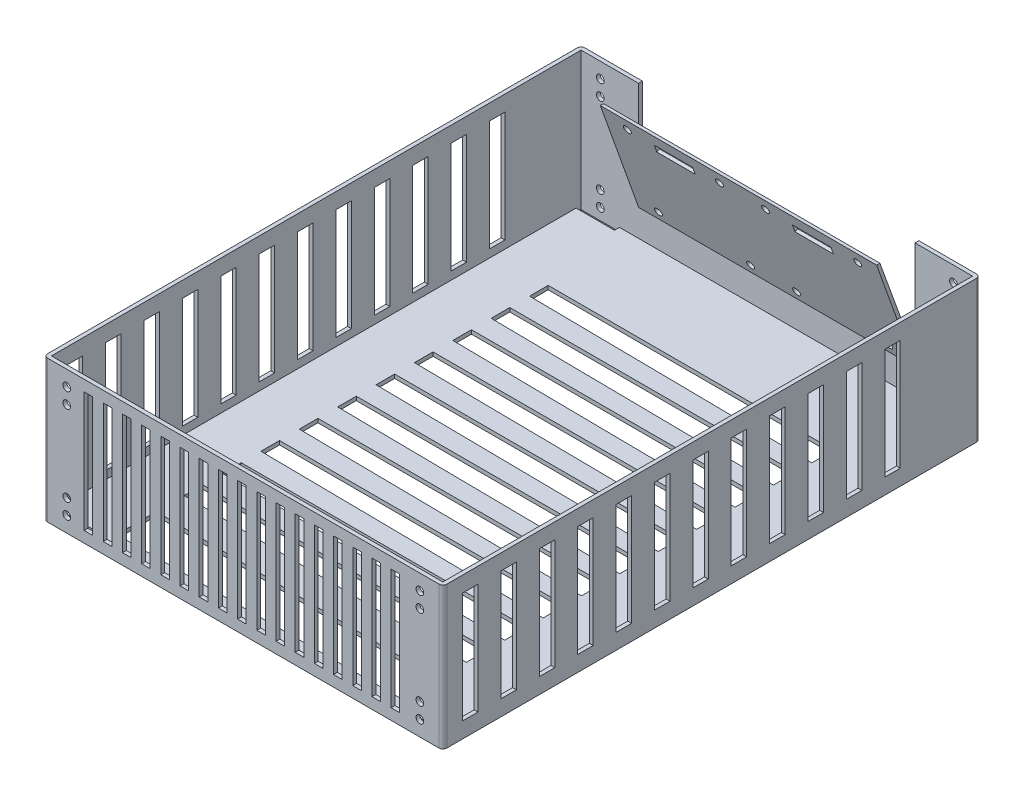
from build123d import *

# Parameters (mm, degrees)
SKETCH2_W                = 104
SKETCH2_H                = 140
BOSS_EXTRUDE1_DEPTH      = 1
BOSS_EXTRUDE2_DEPTH      = 35
BOSS_EXTRUDE2_DEPTH_BACK = 2
SKETCH3_W                = 104
SKETCH3_H                = 140
SKETCH3_W_2              = 102
SKETCH3_H_2              = 138
SKETCH4_W                = 103
SKETCH4_H                = 139
SKETCH4_W_2              = 102
SKETCH4_H_2              = 138
CUT_EXTRUDE1_DEPTH       = 1
FILLET1_R                = 1
SKETCH5_R                = 1
CUT_EXTRUDE2_DEPTH       = 154.622914957
SKETCH6_W                = 4.030555091
SKETCH6_H                = 28.847038514
CUT_EXTRUDE3_DEPTH       = 131.430057885
SKETCH7_W                = 10
SKETCH7_H                = 1.3
CUT_EXTRUDE4_DEPTH       = 94.96275858
CUT_EXTRUDE5_DEPTH       = 10
CUT_EXTRUDE9_DEPTH       = 72
BOSS_EXTRUDE3_DEPTH      = 72
SKETCH12_R               = 1
CUT_EXTRUDE10_DEPTH      = 12
SKETCH13_W               = 2.233840383
SKETCH13_H               = 31.280480748
CUT_EXTRUDE11_DEPTH      = 12


with BuildPart() as part:
    # Sketch2 → Boss-Extrude1 (new body)
    with BuildSketch(Plane(origin=(0, 0, 0), x_dir=(1, 0, 0), z_dir=(0, 1, 0))):
        Rectangle(SKETCH2_W, SKETCH2_H)
    extrude(amount=BOSS_EXTRUDE1_DEPTH)

    # Sketch3 → Boss-Extrude2 (add, two sides: drawn at the far end of the back side and taken through both)
    with BuildSketch(Plane(origin=(0, 1, 0), x_dir=(1, 0, 0), z_dir=(0, 1, 0)).offset(-BOSS_EXTRUDE2_DEPTH_BACK)):
        Rectangle(SKETCH3_W, SKETCH3_H)
        Rectangle(SKETCH3_W_2, SKETCH3_H_2, mode=Mode.SUBTRACT)
    extrude(amount=BOSS_EXTRUDE2_DEPTH + BOSS_EXTRUDE2_DEPTH_BACK)

    # Sketch4 → Cut-Extrude1 (cut)
    with BuildSketch(Plane.XZ.offset(1)):
        Rectangle(SKETCH4_W, SKETCH4_H)
        Rectangle(SKETCH4_W_2, SKETCH4_H_2, mode=Mode.SUBTRACT)
    extrude(amount=-CUT_EXTRUDE1_DEPTH, mode=Mode.SUBTRACT)

    # Fillet1
    fillet1_edges = [part.edges().sort_by_distance(p)[0] for p in [
        (52, 17.5, 70),
        (-52, 17.5, 70),
        (-52, 17.5, -70),
        (52, 17.5, -70),
    ]]
    fillet(fillet1_edges, radius=FILLET1_R)

    # Sketch5 → Cut-Extrude2 (cut, through all)
    with BuildSketch(Plane(origin=(0, 0, -70), x_dir=(-1, 0, 0), z_dir=(0, 0, -1))):
        with Locations((-46, 3)):
            Circle(SKETCH5_R)
        with Locations((46, 7)):
            Circle(SKETCH5_R)
        with Locations((46, 3)):
            Circle(SKETCH5_R)
        with Locations((46, 32)):
            Circle(SKETCH5_R)
        with Locations((-46, 7)):
            Circle(SKETCH5_R)
        with Locations((-46, 28)):
            Circle(SKETCH5_R)
        with Locations((-46, 32)):
            Circle(SKETCH5_R)
        with Locations((46, 28)):
            Circle(SKETCH5_R)
    extrude(amount=-CUT_EXTRUDE2_DEPTH, mode=Mode.SUBTRACT)

    # Sketch6 → Cut-Extrude3 (cut, through all)
    with BuildSketch(Plane(origin=(52, 0, 0), x_dir=(0, 0, -1), z_dir=(1, 0, 0))):
        with Locations((-62.864182494, 17.5)):
            Rectangle(SKETCH6_W, SKETCH6_H)
        with Locations((-52.864182494, 17.5)):
            Rectangle(SKETCH6_W, SKETCH6_H)
        with Locations((-42.864182494, 17.5)):
            Rectangle(SKETCH6_W, SKETCH6_H)
        with Locations((-32.864182494, 17.5)):
            Rectangle(SKETCH6_W, SKETCH6_H)
        with Locations((-22.864182494, 17.5)):
            Rectangle(SKETCH6_W, SKETCH6_H)
        with Locations((-12.864182495, 17.5)):
            Rectangle(SKETCH6_W, SKETCH6_H)
        with Locations((-2.864182495, 17.5)):
            Rectangle(SKETCH6_W, SKETCH6_H)
        with Locations((7.135817506, 17.5)):
            Rectangle(SKETCH6_W, SKETCH6_H)
        with Locations((17.135817506, 17.5)):
            Rectangle(SKETCH6_W, SKETCH6_H)
        with Locations((27.135817506, 17.5)):
            Rectangle(SKETCH6_W, SKETCH6_H)
        with Locations((37.135817506, 17.5)):
            Rectangle(SKETCH6_W, SKETCH6_H)
        with Locations((47.135817506, 17.5)):
            Rectangle(SKETCH6_W, SKETCH6_H)
    extrude(amount=-CUT_EXTRUDE3_DEPTH, mode=Mode.SUBTRACT)

    # Sketch7 → Cut-Extrude4 (cut, through all)
    with BuildSketch(Plane(origin=(0, 1, 0), x_dir=(1, 0, 0), z_dir=(0, 1, 0))):
        with Locations((-46, -68.35)):
            Rectangle(SKETCH7_W, SKETCH7_H)
        with Locations((46, -68.35)):
            Rectangle(SKETCH7_W, SKETCH7_H)
        with Locations((46, 68.35)):
            Rectangle(SKETCH7_W, SKETCH7_H)
        with Locations((-46, 68.35)):
            Rectangle(SKETCH7_W, SKETCH7_H)
    extrude(amount=-CUT_EXTRUDE4_DEPTH, mode=Mode.SUBTRACT)

    # Sketch8 → Cut-Extrude5 (cut)
    with BuildSketch(Plane(origin=(0, 1, 0), x_dir=(1, 0, 0), z_dir=(0, 1, 0))):
        Polygon((37.191706272, -65.781554502), (-37.191706272, -65.781554502), (-37.191706272, -55.449630202), (37.191706272, -56.550369798), align=None)
        Polygon((-37.191706272, -33.37931497), (-37.191706272, -38.224557859), (37.191706272, -39.094929601), (37.191706272, -33.37931497), align=None)
        Polygon((-37.191706272, -48.224557859), (37.191706272, -49.094929601), (37.191706272, -43.37931497), (-37.191706272, -43.37931497), align=None)
        Polygon((-37.191706272, -23.37931497), (-37.191706272, -28.224557859), (37.191706272, -29.094929601), (37.191706272, -23.37931497), align=None)
        Polygon((-37.191706272, -13.37931497), (-37.191706272, -18.224557859), (37.191706272, -19.094929601), (37.191706272, -13.37931497), align=None)
        Polygon((-37.191706272, -3.37931497), (-37.191706272, -8.224557859), (37.191706272, -9.094929601), (37.191706272, -3.37931497), align=None)
        Polygon((-37.191706272, 6.62068503), (-37.191706272, 1.775442141), (37.191706272, 0.905070399), (37.191706272, 6.62068503), align=None)
        Polygon((-37.191706272, 16.62068503), (-37.191706272, 11.775442141), (37.191706272, 10.905070399), (37.191706272, 16.62068503), align=None)
        Polygon((-37.191706272, 26.62068503), (-37.191706272, 21.775442141), (37.191706272, 20.905070399), (37.191706272, 26.62068503), align=None)
        Polygon((-37.191706272, 36.62068503), (-37.191706272, 31.775442141), (37.191706272, 30.905070399), (37.191706272, 36.62068503), align=None)
        Polygon((-37.191706272, 46.62068503), (-37.191706272, 41.775442141), (37.191706272, 40.905070399), (37.191706272, 46.62068503), align=None)
    extrude(amount=-CUT_EXTRUDE5_DEPTH, mode=Mode.SUBTRACT)

    # Sketch9 → Cut-Extrude9 (cut)
    with BuildSketch(Plane(origin=(0, 0, -70), x_dir=(-1, 0, 0), z_dir=(0, 0, -1))):
        Polygon((0, 36), (36, 36), (36, 8), (-36, 8), (-36, 36), align=None)
    extrude(amount=-CUT_EXTRUDE9_DEPTH, mode=Mode.SUBTRACT)

    # Sketch11 → Boss-Extrude3 (add)
    with BuildSketch(Plane(origin=(-36, 0, 0), x_dir=(0, 0, -1), z_dir=(1, 0, 0))):
        Polygon((59.842680228, 36), (59, 36), (69, 8), (70, 8), (60.196618046, 35.024323433), align=None)
    extrude(amount=BOSS_EXTRUDE3_DEPTH)

    # Sketch12 → Cut-Extrude10 (cut)
    with BuildSketch(Plane(origin=(0, 23.370593183, -64.424141785), x_dir=(-1, 0, 0), z_dir=(0, 0.34101652224082957, -0.9400573022740528))):
        with Locations(Location((30, 10.542011025, 0), (0, 0, 90))):
            Circle(SKETCH12_R)
        with Locations(Location((30, -13.457988975, 0), (0, 0, 90))):
            Circle(SKETCH12_R)
        with Locations(Location((6, -13.457988975, 0), (0, 0, 90))):
            Circle(SKETCH12_R)
        with Locations(Location((6, 10.542011025, 0), (0, 0, 90))):
            Circle(SKETCH12_R)
        with Locations(Location((-30, 10.542011025, 0), (0, 0, 90))):
            Circle(SKETCH12_R)
        with Locations(Location((-30, -13.457988975, 0), (0, 0, 90))):
            Circle(SKETCH12_R)
        with Locations(Location((-6, -13.457988975, 0), (0, 0, 90))):
            Circle(SKETCH12_R)
        with Locations(Location((-6, 10.542011025, 0), (0, 0, 90))):
            Circle(SKETCH12_R)
        Polygon((18, 10.542011025), (23, 10.542011025), (23, 8.542011025), (13, 8.542011025), (13, 10.542011025), align=None)
        Polygon((-13, 8.542011025), (-13, 10.542011025), (-18, 10.542011025), (-23, 10.542011025), (-23, 8.542011025), align=None)
    extrude(amount=-CUT_EXTRUDE10_DEPTH, mode=Mode.SUBTRACT)

    # Sketch13 → Cut-Extrude11 (cut)
    with BuildSketch(Plane.XY.offset(70)):
        with Locations((-40.372491493, 17.5)):
            Rectangle(SKETCH13_W, SKETCH13_H)
        with Locations((-35.372491493, 17.5)):
            Rectangle(SKETCH13_W, SKETCH13_H)
        with Locations((-30.372491493, 17.5)):
            Rectangle(SKETCH13_W, SKETCH13_H)
        with Locations((-25.372491493, 17.5)):
            Rectangle(SKETCH13_W, SKETCH13_H)
        with Locations((-20.372491493, 17.5)):
            Rectangle(SKETCH13_W, SKETCH13_H)
        with Locations((-15.372491493, 17.5)):
            Rectangle(SKETCH13_W, SKETCH13_H)
        with Locations((-10.372491493, 17.5)):
            Rectangle(SKETCH13_W, SKETCH13_H)
        with Locations((-5.372491493, 17.5)):
            Rectangle(SKETCH13_W, SKETCH13_H)
        with Locations((-0.372491492, 17.5)):
            Rectangle(SKETCH13_W, SKETCH13_H)
        with Locations((4.627508507, 17.5)):
            Rectangle(SKETCH13_W, SKETCH13_H)
        with Locations((9.627508507, 17.5)):
            Rectangle(SKETCH13_W, SKETCH13_H)
        with Locations((14.627508507, 17.5)):
            Rectangle(SKETCH13_W, SKETCH13_H)
        with Locations((19.627508507, 17.5)):
            Rectangle(SKETCH13_W, SKETCH13_H)
        with Locations((24.627508507, 17.5)):
            Rectangle(SKETCH13_W, SKETCH13_H)
        with Locations((29.627508508, 17.5)):
            Rectangle(SKETCH13_W, SKETCH13_H)
        with Locations((34.627508508, 17.5)):
            Rectangle(SKETCH13_W, SKETCH13_H)
        with Locations((39.627508508, 17.5)):
            Rectangle(SKETCH13_W, SKETCH13_H)
    extrude(amount=-CUT_EXTRUDE11_DEPTH, mode=Mode.SUBTRACT)


solid = part.part
